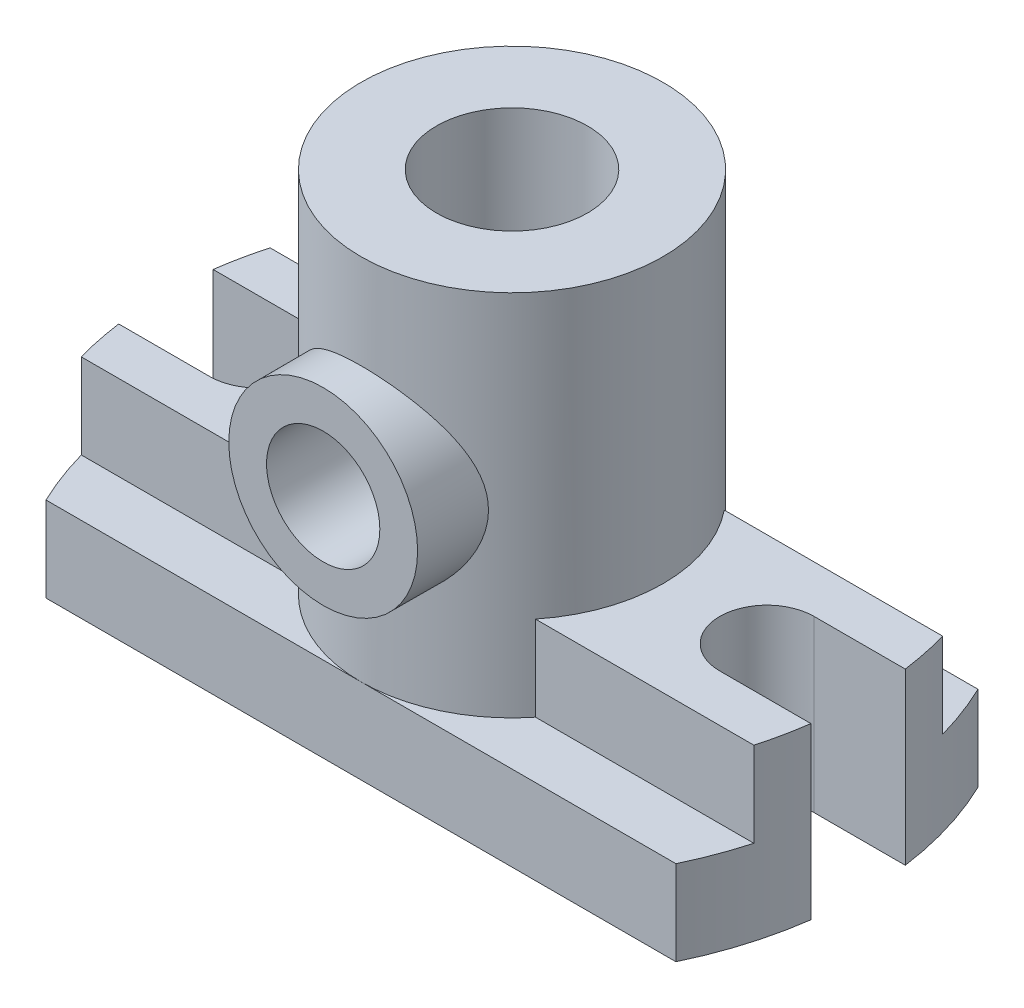
from build123d import *
from build123d.topology import SkipClean

# Parameters (mm, degrees)
SKETCH_2_R          = 8
EXTRUDE_1_DEPTH     = 48
EXTRUDE_2_DEPTH     = 9
EXTRUDE_3_DEPTH     = 18
SKETCH_5_R          = 6
CUT_EXTRUDE_2_DEPTH = 20
EXTRUDE_START       = 20
SKETCH_6_R          = 10
SKETCH_6_R_2        = 6
EXTRUDE_6_DEPTH     = 20
SKETCH_1_R          = 8
CUT_EXTRUDE_4_DEPTH = 48


with BuildPart() as part:
    # 草图2 → 凸台-拉伸1 (new body)
    with BuildSketch(Plane(origin=(0, 0, 0), x_dir=(1, 0, 0), z_dir=(0, 1, 0))):
        with BuildLine():
            ThreePointArc((0, 16), (-6.92820323, 14.422205102), (-12.489995997, 10))
            ThreePointArc((-12.489995997, 10), (-16, 0), (-12.489995997, -10))
            ThreePointArc((-12.489995997, -10), (-6.92820323, -14.422205102), (0, -16))
            ThreePointArc((0, -16), (6.92820323, -14.422205102), (12.489995997, -10))
            ThreePointArc((12.489995997, -10), (16, 0), (12.489995997, 10))
            ThreePointArc((12.489995997, 10), (6.92820323, 14.422205102), (0, 16))
        make_face()
        with Locations(Location((0, 0, 0), (0, 0, 270))):
            Circle(SKETCH_2_R, mode=Mode.SUBTRACT)
    extrude(amount=EXTRUDE_1_DEPTH)

    # 草图3 → 凸台-拉伸2 (add)
    with BuildSketch(Plane(origin=(0, 0, 0), x_dir=(1, 0, 0), z_dir=(0, 1, 0))):
        with BuildLine():
            ThreePointArc((-33.361654635, 16), (-34.622558392, 13.049078527), (-35.623026261, 10))
            Line((-35.623026261, 10), (-12.489995997, 10))
            ThreePointArc((-12.489995997, 10), (-6.92820323, 14.422205102), (0, 16))
            Line((0, 16), (-33.361654635, 16))
        make_face()
        with BuildLine():
            ThreePointArc((0, -16), (-6.92820323, -14.422205102), (-12.489995997, -10))
            Line((-12.489995997, -10), (-35.623026261, -10))
            ThreePointArc((-35.623026261, -10), (-34.622558392, -13.049078527), (-33.361654635, -16))
            Line((-33.361654635, -16), (0, -16))
        make_face()
        with BuildLine():
            Line((33.361654635, 16), (0, 16))
            ThreePointArc((0, 16), (6.92820323, 14.422205102), (12.489995997, 10))
            Line((12.489995997, 10), (35.623026261, 10))
            ThreePointArc((35.623026261, 10), (34.622558392, 13.049078527), (33.361654635, 16))
        make_face()
        with BuildLine():
            ThreePointArc((12.489995997, -10), (6.92820323, -14.422205102), (0, -16))
            Line((0, -16), (33.361654635, -16))
            ThreePointArc((33.361654635, -16), (34.622558392, -13.049078527), (35.623026261, -10))
            Line((35.623026261, -10), (12.489995997, -10))
        make_face()
    extrude(amount=EXTRUDE_2_DEPTH)

    # 草图4 → 凸台-拉伸3 (add)
    with BuildSketch(Plane(origin=(0, 0, 0), x_dir=(1, 0, 0), z_dir=(0, 1, 0))):
        with BuildLine():
            Line((-12.489995997, 10), (-35.623026261, 10))
            ThreePointArc((-35.623026261, 10), (-36.22817767, 7.517921435), (-36.66060556, 5))
            Line((-36.66060556, 5), (-27, 5))
            ThreePointArc((-27, 5), (-22, 0), (-27, -5))
            Line((-27, -5), (-36.66060556, -5))
            ThreePointArc((-36.66060556, -5), (-36.22817767, -7.517921435), (-35.623026261, -10))
            Line((-35.623026261, -10), (-12.489995997, -10))
            ThreePointArc((-12.489995997, -10), (-16, 0), (-12.489995997, 10))
        make_face()
        with BuildLine():
            Line((35.623026261, 10), (12.489995997, 10))
            ThreePointArc((12.489995997, 10), (16, 0), (12.489995997, -10))
            Line((12.489995997, -10), (35.623026261, -10))
            ThreePointArc((35.623026261, -10), (36.22817767, -7.517921435), (36.66060556, -5))
            Line((36.66060556, -5), (27, -5))
            ThreePointArc((27, -5), (22, 0), (27, 5))
            Line((27, 5), (36.66060556, 5))
            ThreePointArc((36.66060556, 5), (36.22817767, 7.517921435), (35.623026261, 10))
        make_face()
    extrude(amount=EXTRUDE_3_DEPTH)

    # 草图5 → 切除-拉伸2 (cut, symmetric)
    with SkipClean():  # the faces are left unmerged after this step: merging them gives an invalid solid
        with BuildSketch(Plane.XY):
            with Locations((0, 28)):
                Circle(SKETCH_5_R)
        extrude(amount=CUT_EXTRUDE_2_DEPTH, both=True, mode=Mode.SUBTRACT)

    # 草图6 → 凸台-拉伸6 (add)
    with SkipClean():  # the faces are left unmerged after this step: merging them gives an invalid solid
        with BuildSketch(Plane.XY.offset(EXTRUDE_START)):
            with Locations(Location((0, 28, 0), (0, 0, 180))):
                Circle(SKETCH_6_R)
            with Locations(Location((0, 28, 0), (0, 0, 90))):
                Circle(SKETCH_6_R_2, mode=Mode.SUBTRACT)
        extrude(amount=-EXTRUDE_6_DEPTH)

    # 草图1 → 切除-拉伸4 (cut)
    with SkipClean():  # the faces are left unmerged after this step: merging them gives an invalid solid
        with BuildSketch(Plane(origin=(0, 0, 0), x_dir=(1, 0, 0), z_dir=(0, 1, 0))):
            with Locations(Location((0, 0, 0), (0, 0, 270))):
                Circle(SKETCH_1_R)
        extrude(amount=CUT_EXTRUDE_4_DEPTH, mode=Mode.SUBTRACT)


solid = part.part
